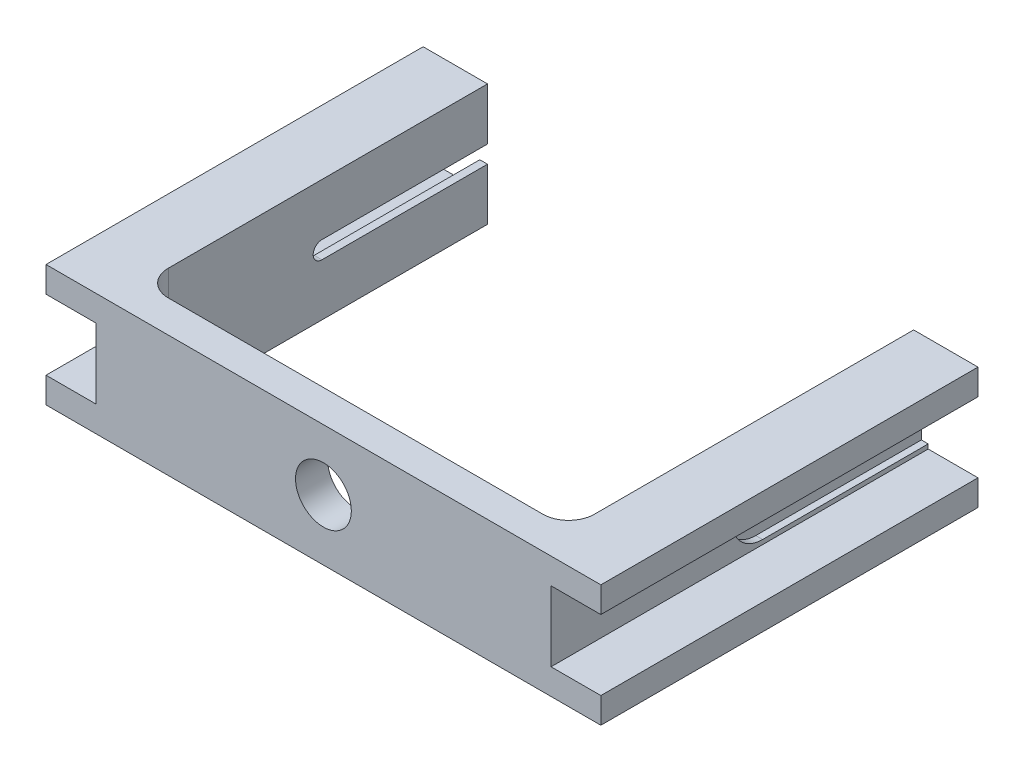
from build123d import *

# Parameters (mm, degrees)
SKETCH1_W           = 42.04380551
SKETCH1_H           = 12
SKETCH1_R           = 2.754
BOSS_EXTRUDE1_DEPTH = 3.175
BOSS_EXTRUDE2_DEPTH = 37.211
CUT_EXTRUDE1_DEPTH  = 63.479858345
CUT_EXTRUDE2_DEPTH  = 0.67464881
CUT_EXTRUDE3_START  = -0.67464881
CUT_EXTRUDE3_DEPTH  = 0.67464881
FILLET1_R           = 2.54
CUT_EXTRUDE4_DEPTH  = 9.906
BOSS_EXTRUDE3_DEPTH = 0.762
BOSS_EXTRUDE4_START = -0.762
BOSS_EXTRUDE4_DEPTH = 0.762


with BuildPart() as part:
    # Sketch1 → Boss-Extrude1 (new body)
    with BuildSketch(Plane.XY):
        Rectangle(SKETCH1_W, SKETCH1_H)
        Circle(SKETCH1_R, mode=Mode.SUBTRACT)
    extrude(amount=-BOSS_EXTRUDE1_DEPTH)

    # Sketch2 → Boss-Extrude2 (add)
    with BuildSketch(Plane.XY):
        Polygon((27.371902755, 3.46), (27.371902755, 6), (21.021902755, 6), (21.021902755, -6), (27.371902755, -6), (27.371902755, -3.46), (22.458551565, -3.46), (22.458551565, 3.46), align=None)
    boss_extrude2 = extrude(amount=-BOSS_EXTRUDE2_DEPTH)

    # Mirror1: Boss-Extrude2 across plane
    add(boss_extrude2.mirror(Plane(origin=(0, 0, 0), x_dir=(0, 0, 1), z_dir=(1, 0, 0))))

    # Sketch3 → Cut-Extrude1 (cut, through all)
    with BuildSketch(Plane(origin=(22.458551565, 0, 0), x_dir=(0, 0, -1), z_dir=(1, 0, 0))):
        with BuildLine():
            Line((31.771902755, 1.75), (20.871902755, 1.75))
            ThreePointArc((20.871902755, 1.75), (19.121902755, 0), (20.871902755, -1.75))
            Line((20.871902755, -1.75), (31.771902755, -1.75))
            ThreePointArc((31.771902755, -1.75), (33.521902755, 0), (31.771902755, 1.75))
        make_face()
    extrude(amount=-CUT_EXTRUDE1_DEPTH, mode=Mode.SUBTRACT)

    # Sketch4 → Cut-Extrude2 (cut)
    with BuildSketch(Plane(origin=(22.458551565, 0, 0), x_dir=(0, 0, -1), z_dir=(1, 0, 0))):
        with BuildLine():
            Line((31.771902755, 3.02), (20.871902755, 3.02))
            ThreePointArc((20.871902755, 3.02), (17.851902755, 0), (20.871902755, -3.02))
            Line((20.871902755, -3.02), (31.771902755, -3.02))
            ThreePointArc((31.771902755, -3.02), (34.791902755, 0), (31.771902755, 3.02))
        make_face()
    extrude(amount=-CUT_EXTRUDE2_DEPTH, mode=Mode.SUBTRACT)

    # Sketch5 → Cut-Extrude3 (cut)
    with BuildSketch(Plane.ZY.offset(22.458551565).offset(CUT_EXTRUDE3_START)):
        with BuildLine():
            Line((-20.871902755, 3.02), (-31.771902755, 3.02))
            ThreePointArc((-31.771902755, 3.02), (-34.791902755, 0), (-31.771902755, -3.02))
            Line((-31.771902755, -3.02), (-20.871902755, -3.02))
            ThreePointArc((-20.871902755, -3.02), (-17.851902755, 0), (-20.871902755, 3.02))
        make_face()
    extrude(amount=CUT_EXTRUDE3_DEPTH, mode=Mode.SUBTRACT)

    # Fillet1
    fillet1_edges = [part.edges().sort_by_distance(p)[0] for p in [
        (-21.021902755, 0, -3.175),
        (21.021902755, 0, -3.175),
    ]]
    fillet(fillet1_edges, radius=FILLET1_R)

    # Sketch6 → Cut-Extrude4 (cut)
    with BuildSketch(Plane(origin=(0, 0, -37.211), x_dir=(-1, 0, 0), z_dir=(0, 0, -1))):
        Polygon((-21.783902755, -3.02), (-22.458551565, -3.02), (-22.458551565, 3.02), (-21.783902755, 3.02), (-21.783902755, 1.75), (-21.021902755, 1.75), (-21.021902755, -1.75), (-21.783902755, -1.75), align=None)
    cut_extrude4 = extrude(amount=-CUT_EXTRUDE4_DEPTH, mode=Mode.SUBTRACT)

    # Mirror2: Cut-Extrude4 across plane
    add(cut_extrude4.mirror(Plane(origin=(0, 0, 0), x_dir=(0, 0, 1), z_dir=(1, 0, 0))), mode=Mode.SUBTRACT)

    # Sketch8 → Boss-Extrude3 (add)
    with BuildSketch(Plane(origin=(-21.021902755, 0, 0), x_dir=(0, 0, -1), z_dir=(1, 0, 0))):
        with BuildLine():
            Line((20.871902755, 0.861), (37.211, 0.861))
            Line((37.211, 0.861), (37.211, 1.75))
            Line((37.211, 1.75), (20.871902755, 1.75))
            ThreePointArc((20.871902755, 1.75), (19.121902755, 0), (20.871902755, -1.75))
            Line((20.871902755, -1.75), (37.211, -1.75))
            Line((37.211, -1.75), (37.211, -0.861))
            Line((37.211, -0.861), (20.871902755, -0.861))
            ThreePointArc((20.871902755, -0.861), (20.010902755, 0), (20.871902755, 0.861))
        make_face()
    extrude(amount=-BOSS_EXTRUDE3_DEPTH)

    # Sketch9 → Boss-Extrude4 (add)
    with BuildSketch(Plane.ZY.offset(-21.021902755).offset(BOSS_EXTRUDE4_START)):
        with BuildLine():
            Line((-20.871902755, -3.02), (-37.211, -3.02))
            Line((-37.211, -3.02), (-37.211, -0.861))
            Line((-37.211, -0.861), (-20.871902755, -0.861))
            ThreePointArc((-20.871902755, -0.861), (-20.010902755, 0), (-20.871902755, 0.861))
            Line((-20.871902755, 0.861), (-37.211, 0.861))
            Line((-37.211, 0.861), (-37.211, 3.02))
            Line((-37.211, 3.02), (-20.871902755, 3.02))
            ThreePointArc((-20.871902755, 3.02), (-17.851902755, 0), (-20.871902755, -3.02))
        make_face()
    extrude(amount=BOSS_EXTRUDE4_DEPTH)


solid = part.part
